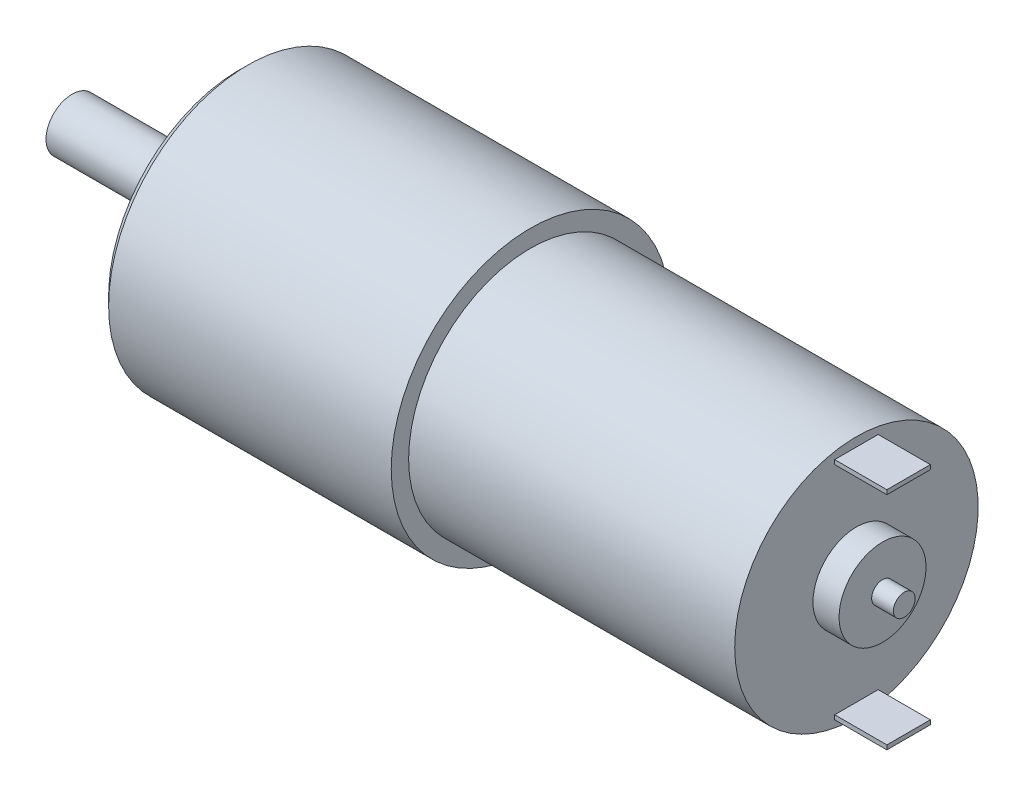
from build123d import *

# Parameters (mm, degrees)
SKETCH_2_OUTSIDE_W       = 55.172
SKETCH_2_OUTSIDE_H       = 55.172
SKETCH_2_OUTSIDE_W_2     = 20
SKETCH_2_OUTSIDE_H_2     = 18
CUT_EXTRUDE_1_DEPTH      = 3
CHAMFER_1_SIZE           = 1
SKETCH_3_R               = 1.5
CUT_EXTRUDE_3_DEPTH      = 3
PATTERN_CIRCULAR_2_COUNT = 4
EXTRUDE_2_DEPTH          = 6
PATTERN_CIRCULAR_3_COUNT = 2


with BuildPart() as part:
    # ｽｹｯﾁ1 → 回転2 (revolve)
    with BuildSketch(Plane(origin=(0, 0, 0), x_dir=(1, 0, 0), z_dir=(0, 1, 0)), mode=Mode.PRIVATE) as revolve_2_sk:
        Polygon((0, 0), (0, 3), (15, 3), (15, 5.5), (15.8, 5.5), (15.8, 7), (16.2, 7), (16.2, 10), (19.2, 10), (19.2, 16), (52.7, 16), (52.7, 14), (90.2, 14), (90.2, 5), (93.2, 5), (93.2, 1.25), (95.7, 1.25), (95.7, 0), align=None)
    revolve(revolve_2_sk.sketch.rotate(Axis((0, 0, 0), (1, 0, 0)), 180), axis=Axis((0, 0, 0), (1, 0, 0)))

    # ｽｹｯﾁ2 outside → ｶｯﾄ - 押し出し1 (cut)
    with BuildSketch(Plane.ZY.offset(-16.2)):
        Rectangle(SKETCH_2_OUTSIDE_W, SKETCH_2_OUTSIDE_H)
        Rectangle(SKETCH_2_OUTSIDE_W_2, SKETCH_2_OUTSIDE_H_2, mode=Mode.SUBTRACT)
    extrude(amount=-CUT_EXTRUDE_1_DEPTH, mode=Mode.SUBTRACT)

    # 面取り1
    chamfer_1_edges = [part.edges().sort_by_distance(p)[0] for p in [
        (19.2, 0, -16),
    ]]
    chamfer(chamfer_1_edges, length=CHAMFER_1_SIZE)

    # ｽｹｯﾁ3 → ｶｯﾄ - 押し出し3 (cut)
    with BuildSketch(Plane.ZY.offset(-19.2)):
        with Locations((-9.192388155, -9.192388155)):
            Circle(SKETCH_3_R)
    cut_extrude_3 = extrude(amount=-CUT_EXTRUDE_3_DEPTH, mode=Mode.SUBTRACT)

    # 円形ﾊﾟﾀｰﾝ2: ｶｯﾄ - 押し出し3 ×4 about axis
    pattern_circular_2_axis = Axis((0, 0, 0), (1, 0, 0))
    for i in range(1, PATTERN_CIRCULAR_2_COUNT):
        add(cut_extrude_3.rotate(pattern_circular_2_axis, i * 360 / PATTERN_CIRCULAR_2_COUNT), mode=Mode.SUBTRACT)

    # ｽｹｯﾁ4 → ﾎﾞｽ - 押し出し2 (add)
    with BuildSketch(Plane(origin=(90.2, 0, 0), x_dir=(0, 0, -1), z_dir=(1, 0, 0))):
        Polygon((0, 12.956973635), (2.5, 12.956973635), (2.5, 12.456973635), (-2.5, 12.456973635), (-2.5, 12.956973635), align=None)
    extrude_2 = extrude(amount=EXTRUDE_2_DEPTH)

    # 円形ﾊﾟﾀｰﾝ3: ﾎﾞｽ - 押し出し2 ×2 about axis
    pattern_circular_3_axis = Axis((0, 0, 0), (1, 0, 0))
    for i in range(1, PATTERN_CIRCULAR_3_COUNT):
        add(extrude_2.rotate(pattern_circular_3_axis, i * 360 / PATTERN_CIRCULAR_3_COUNT))


solid = part.part
